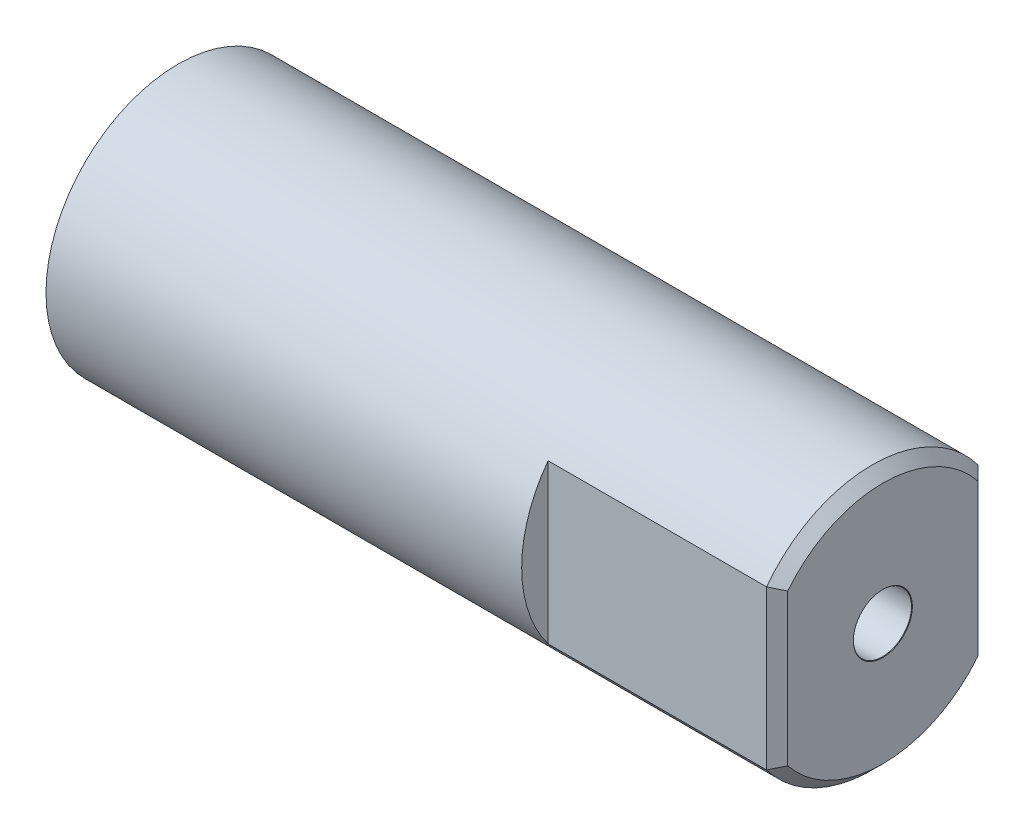
from build123d import *

# Parameters (mm, degrees)
SKETCH1_W                         = 40
SKETCH1_H                         = 7.5
TAP_DRILL_FOR_M4_TAP1_D           = 3.3
TAP_DRILL_FOR_M4_TAP1_DEPTH       = 10
TAP_DRILL_FOR_M4_TAP1_CSINK_D     = 3.35
TAP_DRILL_FOR_M4_TAP1_CSINK_ANGLE = 90
TAP_DRILL_FOR_M4_TAP1_TIP         = 0.991420021
CUT_EXTRUDE1_DEPTH                = 13
CHAMFER1_SIZE                     = 0.6


with BuildPart() as part:
    # Sketch1 → Revolve1 (revolve)
    with BuildSketch(Plane.XY):
        with Locations((20, 3.75)):
            Rectangle(SKETCH1_W, SKETCH1_H)
    revolve(axis=Axis((40, 0, 0), (-1, 0, 0)))

    # Tap Drill for M4 Tap1
    with Locations(Plane(origin=(40, 0, 0), x_dir=(0, 0, -1), z_dir=(1, 0, 0))):
        with Locations((0, 0)):
            CounterSinkHole(TAP_DRILL_FOR_M4_TAP1_D / 2, TAP_DRILL_FOR_M4_TAP1_CSINK_D / 2, depth=TAP_DRILL_FOR_M4_TAP1_DEPTH, counter_sink_angle=TAP_DRILL_FOR_M4_TAP1_CSINK_ANGLE)
            with Locations((0, 0, -(TAP_DRILL_FOR_M4_TAP1_DEPTH + TAP_DRILL_FOR_M4_TAP1_TIP / 2))):  # 118° drill point
                Cone(0, TAP_DRILL_FOR_M4_TAP1_D / 2, TAP_DRILL_FOR_M4_TAP1_TIP, mode=Mode.SUBTRACT)

    # Sketch6 → Cut-Extrude1 (cut)
    with BuildSketch(Plane(origin=(40, 0, 0), x_dir=(0, 0, -1), z_dir=(1, 0, 0))):
        with BuildLine():
            Line((-6, -4.5), (-6, 4.5))
            ThreePointArc((-6, 4.5), (-7.5, 0), (-6, -4.5))
        make_face()
        with BuildLine():
            ThreePointArc((7.5, 0), (7.115124735, 2.371708245), (6, 4.5))
            Line((6, 4.5), (6, -4.5))
            ThreePointArc((6, -4.5), (7.115124735, -2.371708245), (7.5, 0))
        make_face()
    extrude(amount=-CUT_EXTRUDE1_DEPTH, mode=Mode.SUBTRACT)

    # Chamfer1
    chamfer1_edges = [part.edges().sort_by_distance(p)[0] for p in [
        (40, -7.5, 0),
        (40, 6.708203932, -3.354101966),
        (40, 0, 6),
        (40, 0, -6),
    ]]
    chamfer(chamfer1_edges, length=CHAMFER1_SIZE)


solid = part.part
